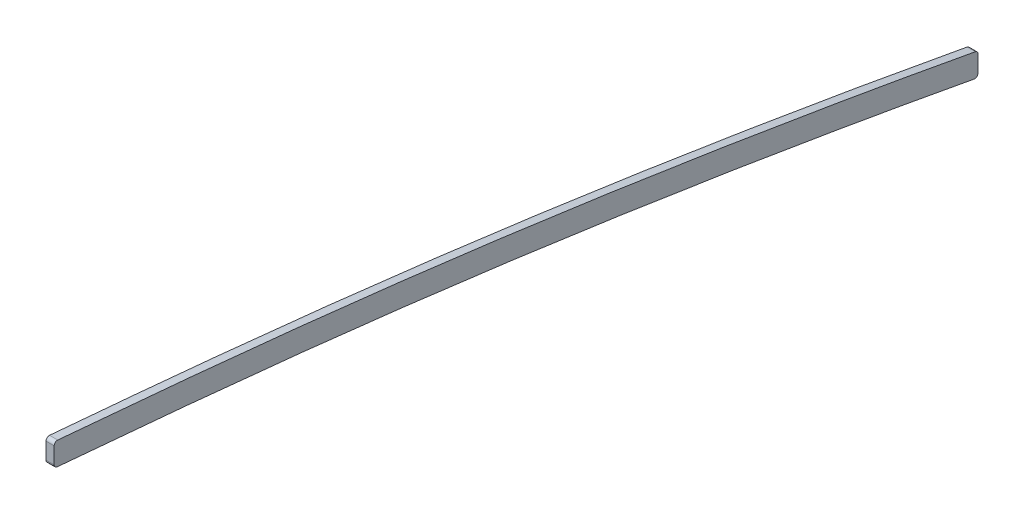
from build123d import *

# Parameters (mm, degrees)
BOSS_EXTRUDE1_DEPTH = 1.5875
FILLET1_R           = 1.27


with BuildPart() as part:
    # Sketch2 → Boss-Extrude1 (new, symmetric)
    with BuildSketch(Plane(origin=(0, 0, 0), x_dir=(0, 0, -1), z_dir=(1, 0, 0))):
        with BuildLine():
            Line((2311.4, 87.288523189), (2311.4, 78.366424638))
            add(Edge.make_bspline(
                [(2311.4, 78.366424638), (2316.422531269, 77.938965796), (2326.465798303, 77.072769892), (2355.87015988, 74.461943474), (2400.271952644, 70.201698936), (2479.570468264, 61.127378254), (2559.292087872, 49.650907614), (2626.797554585, 38.235484735), (2656.889518578, 32.788503969), (2667.159793662, 30.877771266), (2669.54, 30.432069924)],
                knots=[0.595962005, 0.595962005, 0.595962005, 0.595962005, 0.611587005, 0.627212005, 0.6875, 0.75, 0.875, 0.9375, 0.96241067, 0.969928536, 0.969928536, 0.969928536, 0.969928536], degree=3))
            Line((2669.54, 30.432069924), (2669.54, 39.476142465))
            add(Edge.make_bspline(
                [(2311.4, 87.288523189), (2320.997112773, 86.472755043), (2330.592544535, 85.637637379), (2350.239356518, 83.874334847), (2360.290489794, 82.943307484), (2380.385973971, 81.003183297), (2390.430065378, 79.993418555), (2420.547026195, 76.827577532), (2440.60648589, 74.533672955), (2480.675569568, 69.556278523), (2500.68715183, 66.874150811), (2540.654290207, 61.150246295), (2560.611026428, 58.109755646), (2600.475457131, 51.702465574), (2620.382967089, 48.337538888), (2650.028116889, 43.072156367), (2659.78844051, 41.29687683), (2669.54, 39.476142465)],
                knots=[0.595181211, 0.595181211, 0.595181211, 0.595181211, 0.625, 0.625, 0.65625, 0.65625, 0.6875, 0.6875, 0.75, 0.75, 0.8125, 0.8125, 0.875, 0.875, 0.9375, 0.9375, 0.968210768, 0.968210768, 0.968210768, 0.968210768], degree=3))
        make_face()
    extrude(amount=BOSS_EXTRUDE1_DEPTH, both=True)

    # Fillet1
    fillet1_edges = [part.edges().sort_by_distance(p)[0] for p in [
        (-0.79375, 78.366424638, -2311.4),
        (-0.79375, 87.288523189, -2311.4),
        (-0.79375, 30.432069924, -2669.54),
        (-0.79375, 39.476142465, -2669.54),
    ]]
    fillet(fillet1_edges, radius=FILLET1_R)


solid = part.part
